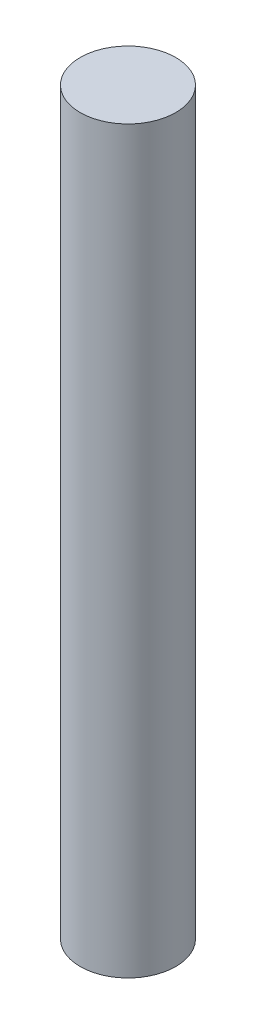
from build123d import *

# Parameters (mm, degrees)
ESQUISSE1_R        = 1.55
BOSS_EXTRU_1_DEPTH = 24


with BuildPart() as part:
    # Esquisse1 → Boss.-Extru.1 (new body)
    with BuildSketch(Plane(origin=(0, 0, 0), x_dir=(1, 0, 0), z_dir=(0, 1, 0))):
        with Locations(Location((0, 0, 0), (0, 0, 270))):
            Circle(ESQUISSE1_R)
    extrude(amount=BOSS_EXTRU_1_DEPTH)


solid = part.part
